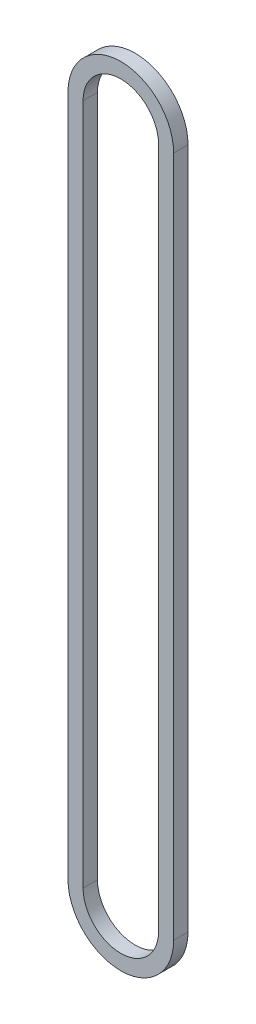
from build123d import *

# Parameters (mm, degrees)
BOSS_EXTRUDE1_DEPTH = 3.81


with BuildPart() as part:
    # Sketch1 → Boss-Extrude1 (new body)
    with BuildSketch(Plane.XY):
        with BuildLine():
            Line((14, 90.335447546), (14, -90.335447546))
            ThreePointArc((14, -90.335447546), (0, -104.335447546), (-14, -90.335447546))
            Line((-14, -90.335447546), (-14, 90.335447546))
            ThreePointArc((-14, 90.335447546), (0, 104.335447546), (14, 90.335447546))
        make_face()
        with BuildLine():
            Line((-10, -90.335447546), (-10, 90.335447546))
            ThreePointArc((-10, 90.335447546), (0, 100.335447546), (10, 90.335447546))
            Line((10, 90.335447546), (10, -90.335447546))
            ThreePointArc((10, -90.335447546), (0, -100.335447546), (-10, -90.335447546))
        make_face(mode=Mode.SUBTRACT)
    extrude(amount=BOSS_EXTRUDE1_DEPTH)


solid = part.part
